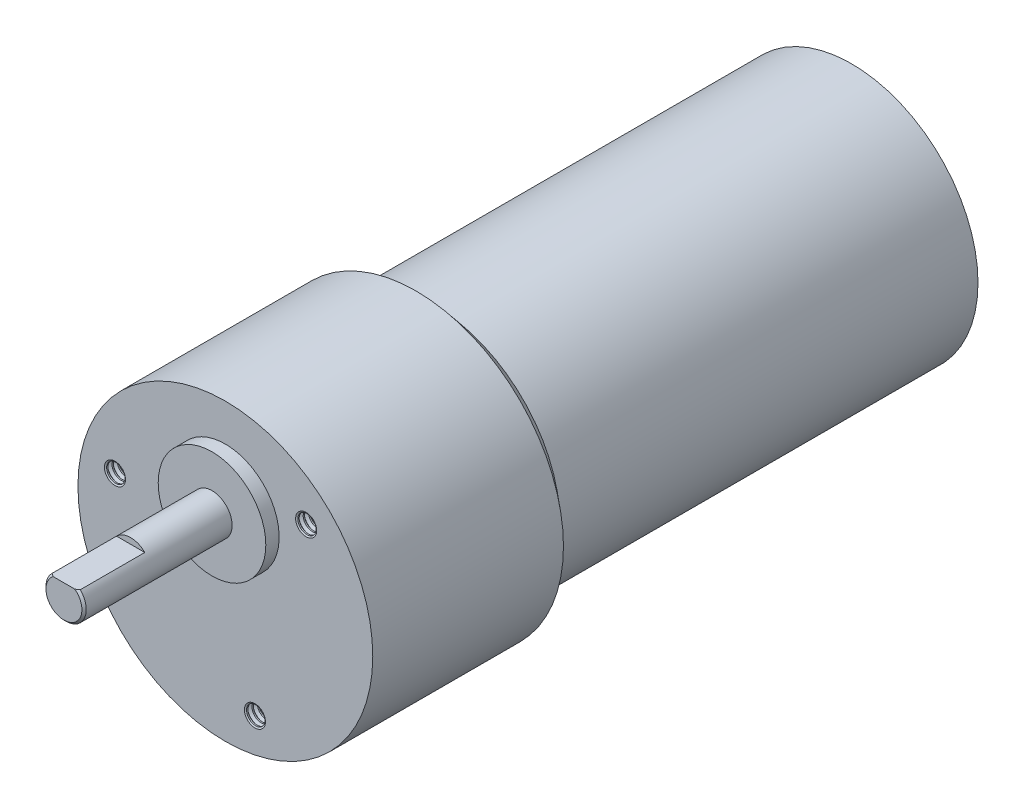
from build123d import *

# Parameters (mm, degrees)
SKETCH1_R          = 6.35
EXTRUDE1_DEPTH     = 1.5748
SKETCH2_R          = 14.9225
EXTRUDE2_DEPTH     = 73.914
SKETCH3_R          = 2.3749
EXTRUDE3_DEPTH     = 19.05
CIRPATTERN1_COUNT  = 3
SKETCH14_W         = 3.33891671
SKETCH14_H         = 0.6858
CUT_EXTRUDE3_DEPTH = 7.874
CHAMFER1_SIZE      = 0.254


with BuildPart() as part:
    # Sketch1 → Extrude1 (new body)
    with BuildSketch(Plane.XY):
        with Locations((0, 6.6548)):
            Circle(SKETCH1_R)
    extrude(amount=EXTRUDE1_DEPTH)

    # Sketch2 → Extrude2 (add)
    with BuildSketch(Plane(origin=(0, 0, 0), x_dir=(-1, 0, 0), z_dir=(0, 0, -1))):
        with Locations(Location((0, 0, 0), (0, 0, 180))):
            Circle(SKETCH2_R)
    extrude(amount=EXTRUDE2_DEPTH)

    # Sketch3 → Extrude3 (add)
    with BuildSketch(Plane.XY):
        with Locations(Location((0, 6.6548, 0), (0, 0, 180))):
            Circle(SKETCH3_R)
    extrude(amount=EXTRUDE3_DEPTH)

    # Sketch9 → Revolve1 (revolve)
    with BuildSketch(Plane(origin=(0, 0, 0), x_dir=(0, 0, -1), z_dir=(1, 0, 0)), mode=Mode.PRIVATE) as revolve1_sk:
        Polygon((73.914, 0), (73.914, 6.35), (75.4888, 6.35), (75.4888, 1.9812), (76.7588, 1.9812), (76.7588, 0), align=None)
    revolve(revolve1_sk.sketch.rotate(Axis((0, 0, -51.186992867), (0, 0, -1)), 90), axis=Axis((0, 0, -51.186992867), (0, 0, -1)))

    # Sketch13 → Revolve3 (revolve)
    with BuildSketch(Plane(origin=(0, 0, 0), x_dir=(0, 0, -1), z_dir=(1, 0, 0)), mode=Mode.PRIVATE) as revolve3_sk:
        Polygon((0, 14.9225), (0, 17.399), (22.509169763, 17.399), (24.5872, 14.9225), align=None)
    revolve(revolve3_sk.sketch.rotate(Axis((0, 0, 4.819894785), (0, 0, -1)), 90), axis=Axis((0, 0, 4.819894785), (0, 0, -1)))

    # Sketch7 → Cut-Revolve1 (revolve, cut)
    with BuildSketch(Plane(origin=(0, 0, 0), x_dir=(0, 0, -1), z_dir=(-0.9659258262890681, -0.2588190451025213, 0)), mode=Mode.PRIVATE) as cut_revolve1_sk:
        Polygon((-0.381, 13.4874), (5.334, 13.4874), (5.334, 14.566096168), (5.17525, 14.566096168), (4.9768125, 14.9098), (4.8974375, 14.9098), (4.699, 14.566096168), (4.54025, 14.566096168), (4.3418125, 14.9098), (4.2624375, 14.9098), (4.064, 14.566096168), (3.90525, 14.566096168), (3.7068125, 14.9098), (3.6274375, 14.9098), (3.429, 14.566096168), (3.27025, 14.566096168), (3.0718125, 14.9098), (2.9924375, 14.9098), (2.794, 14.566096168), (2.63525, 14.566096168), (2.4368125, 14.9098), (2.3574375, 14.9098), (2.159, 14.566096168), (2.00025, 14.566096168), (1.8018125, 14.9098), (1.7224375, 14.9098), (1.524, 14.566096168), (1.36525, 14.566096168), (1.1668125, 14.9098), (1.0874375, 14.9098), (0.889, 14.566096168), (0.73025, 14.566096168), (0.5318125, 14.9098), (0.4524375, 14.9098), (0.254, 14.566096168), (0.09525, 14.566096168), (-0.1031875, 14.9098), (-0.1825625, 14.9098), (-0.381, 14.566096168), align=None)
    cut_revolve1 = revolve(cut_revolve1_sk.sketch.rotate(Axis((3.490795989, -13.027827989, 0.218691166), (0, 0, -1)), 285), axis=Axis((3.490795989, -13.027827989, 0.218691166), (0, 0, -1)), mode=Mode.SUBTRACT)

    # CirPattern1: Cut-Revolve1 ×3 about axis
    cirpattern1_axis = Axis((0, 0, 0), (0, 0, 1))
    for i in range(1, CIRPATTERN1_COUNT):
        add(cut_revolve1.rotate(cirpattern1_axis, i * 360 / CIRPATTERN1_COUNT), mode=Mode.SUBTRACT)

    # Sketch14 → Cut-Extrude3 (cut)
    with BuildSketch(Plane.XY.offset(19.05)):
        with Locations((0, 8.6868)):
            Rectangle(SKETCH14_W, SKETCH14_H)
    extrude(amount=-CUT_EXTRUDE3_DEPTH, mode=Mode.SUBTRACT)

    # Chamfer1
    chamfer1_edges = [part.edges().sort_by_distance(p)[0] for p in [
        (0.915246787, 4.463345385, 19.05),
        (-1.9812, 0, -76.7588),
    ]]
    chamfer(chamfer1_edges, length=CHAMFER1_SIZE)


solid = part.part
